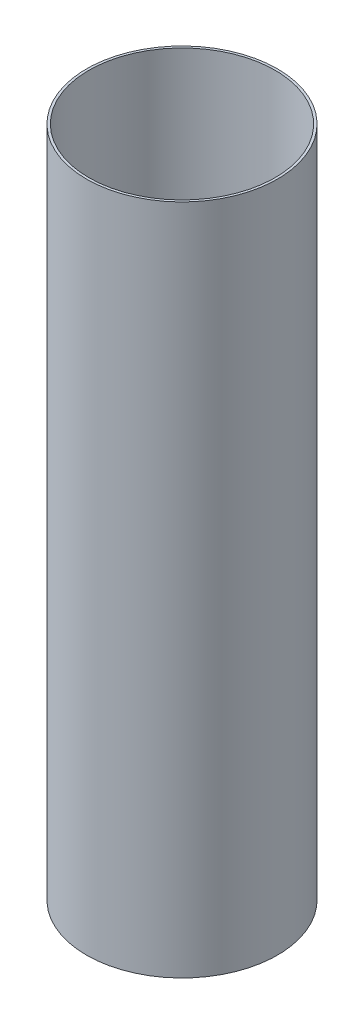
from build123d import *

# Parameters (mm, degrees)
SKETCH1_W = 1.96
SKETCH1_H = 550


with BuildPart() as part:
    # Sketch1 → Revolve1 (revolve)
    with BuildSketch(Plane.XY, mode=Mode.PRIVATE) as revolve1_sk:
        with Locations((77.18, 275)):
            Rectangle(SKETCH1_W, SKETCH1_H)
    revolve(revolve1_sk.sketch.rotate(Axis((0, 204.615384615, 0), (0, -1, 0)), 90), axis=Axis((0, 204.615384615, 0), (0, -1, 0)))


solid = part.part
